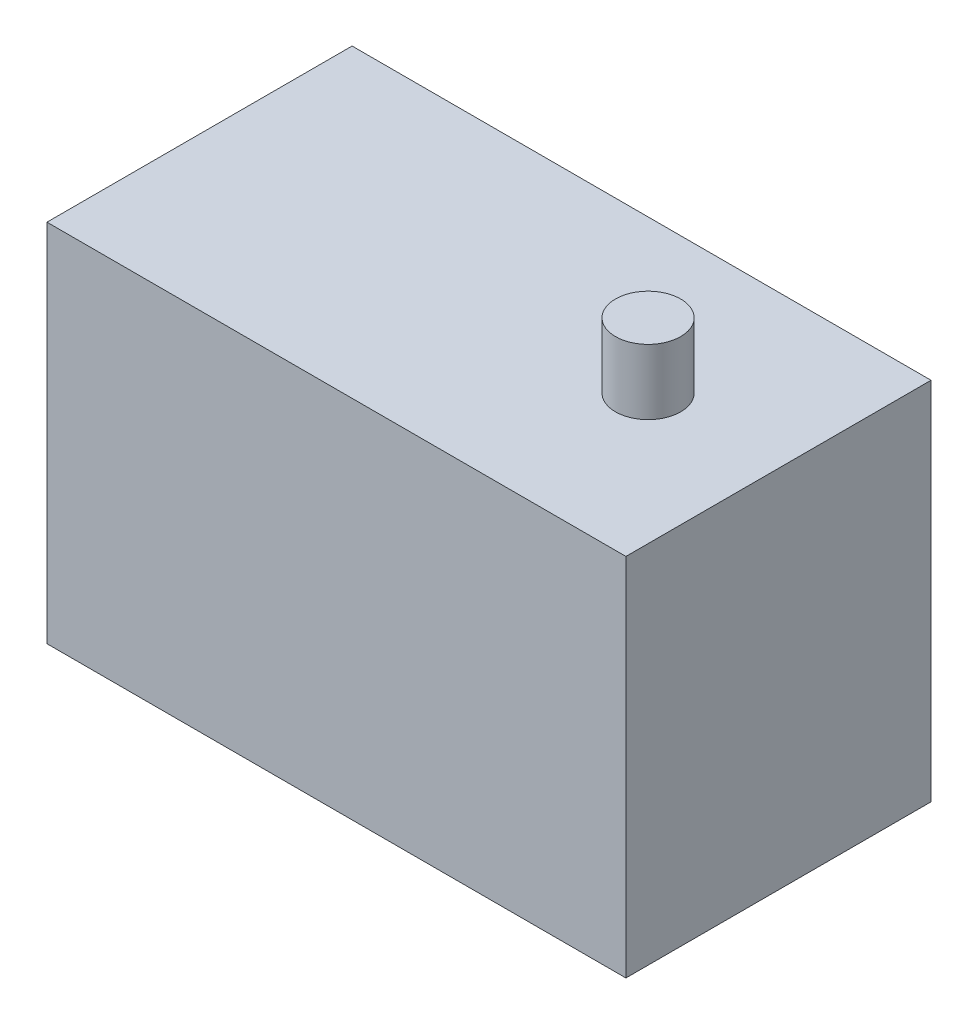
from build123d import *

# Parameters (mm, degrees)
SKETCH_1_W             = 44.4
SKETCH_1_H             = 23.4
EXTRUDE_1_DEPTH        = 28
SKETCH_2_R             = 2.5
EXTRUDE_2_DEPTH        = 5
PATTERN_LINEAR_1_COUNT = 2
PATTERN_LINEAR_1_PITCH = 33


with BuildPart() as part:
    # 草圖1 → 填料-伸長1 (new body)
    with BuildSketch(Plane(origin=(0, 0, 0), x_dir=(1, 0, 0), z_dir=(0, 1, 0))):
        with Locations((-19.947783251, 11.493103448)):
            Rectangle(SKETCH_1_W, SKETCH_1_H)
    extrude(amount=EXTRUDE_1_DEPTH)

    # 草圖2 → 填料-伸長2 (add)
    with BuildSketch(Plane(origin=(0, 0, 0), x_dir=(1, 0, 0), z_dir=(0, 1, 0))):
        with Locations(Location((-7.747783251, 11.493103448, 0), (0, 0, 270))):
            Circle(SKETCH_2_R)
    extrude_2 = extrude(amount=-EXTRUDE_2_DEPTH)

    # 直線複製排列1: 填料-伸長2 ×2
    with Locations(*[(0, i * PATTERN_LINEAR_1_PITCH, 0) for i in range(1, PATTERN_LINEAR_1_COUNT)]):
        add(extrude_2)


solid = part.part
